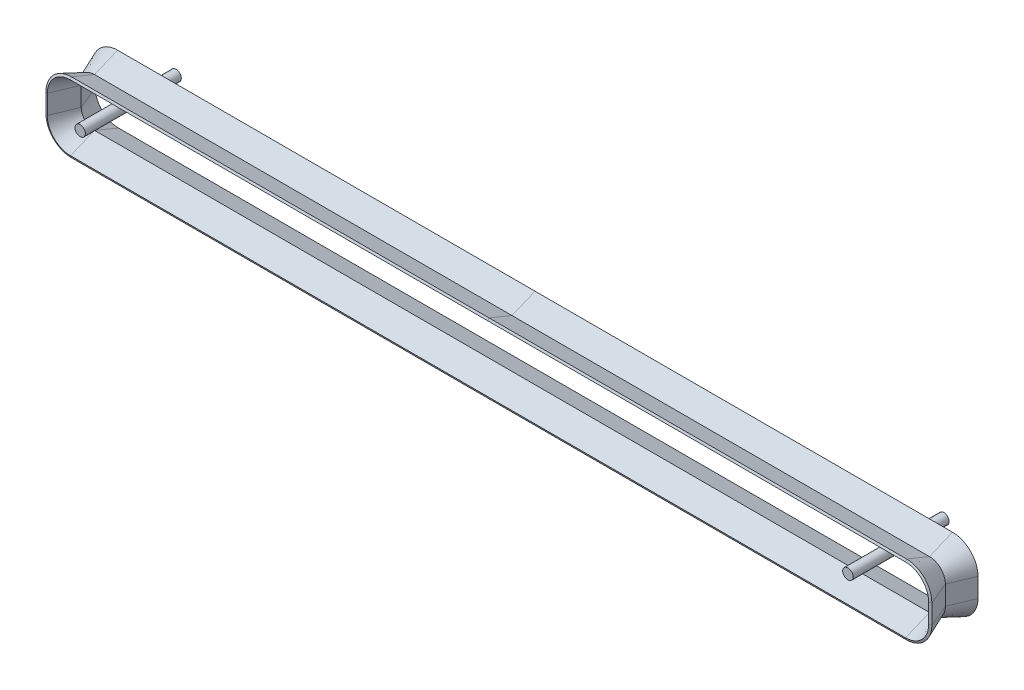
from build123d import *

# Parameters (mm, degrees)
CROQUIS61_R               = 10.861013232
SALIENTE_EXTRUIR2_DEPTH   = 100
SALIENTE_EXTRUIR2_2_DEPTH = 100


with BuildPart() as part:
    # Barrer8: sweep along a path in Croquis59
    with BuildLine(Plane.XY) as barrer8_path:
        Line((-870, 2.292783659), (870, 2.292783659))
        ThreePointArc((870, 2.292783659), (891.213203436, -6.494012905), (900, -27.707216341))
        Line((900, -27.707216341), (900, -67.707216341))
        ThreePointArc((900, -67.707216341), (891.213203436, -88.920419776), (870, -97.707216341))
        Line((870, -97.707216341), (-870, -97.707216341))
        ThreePointArc((-870, -97.707216341), (-891.213203436, -88.920419776), (-900, -67.707216341))
        Line((-900, -67.707216341), (-900, -27.707216341))
        ThreePointArc((-900, -27.707216341), (-891.213203436, -6.494012905), (-870, 2.292783659))
    # Croquis58 → Barrer8 (sweep)
    with BuildSketch(Plane(origin=(0, 0, 0), x_dir=(0, 0, -1), z_dir=(1, 0, 0))):
        Polygon((0, 0), (-50, 20.710678119), (-48.086582838, 25.330075781), (0, 5.411961001), (48.086582838, 25.330075781), (50, 20.710678119), align=None)
    sweep(path=barrer8_path.line)


with BuildPart() as body_2:
    # Croquis61 → Saliente-Extruir2 (new, symmetric)
    with BuildSketch(Plane.XY):
        with Locations((-800, -10.861013232)):
            Circle(CROQUIS61_R)
    extrude(amount=SALIENTE_EXTRUIR2_DEPTH, both=True)


with BuildPart() as body_3:
    # Croquis61 → Saliente-Extruir2 2 (new, symmetric)
    with BuildSketch(Plane.XY):
        with Locations(Location((800, -10.861013232, 0), (0, 0, 180))):
            Circle(CROQUIS61_R)
    extrude(amount=SALIENTE_EXTRUIR2_2_DEPTH, both=True)


solid = Compound([part.part, body_2.part, body_3.part])
